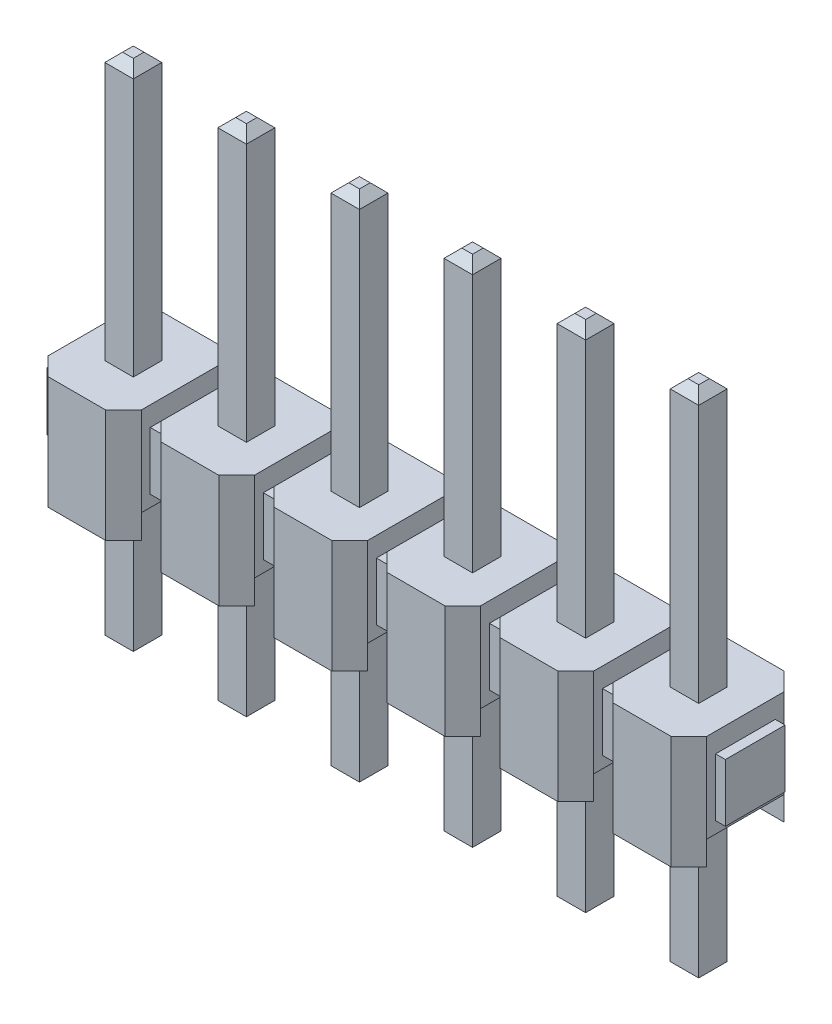
from build123d import *

# Parameters (mm, degrees)
EXTRUDE_2_DEPTH                    = 2.54
EXTRUDE_2_2_DEPTH                  = 2.54
EXTRUDE_2_3_DEPTH                  = 2.54
EXTRUDE_2_4_DEPTH                  = 2.54
EXTRUDE_2_5_DEPTH                  = 2.54
EXTRUDE_2_6_DEPTH                  = 2.54
EXTRUDE_START                      = 0.8
SKETCH_3_W                         = 0.22
SKETCH_3_H                         = 1.34
EXTRUDE_3_DEPTH                    = 1.3
SKETCH_4_W                         = 1.74
SKETCH_4_H                         = 0.54
CUT_EXTRUDE_1_DEPTH                = 16.28610153
EXTRUDE_START_2                    = -3
SKETCH_5_W                         = 0.64
SKETCH_5_H                         = 0.64
EXTRUDE_4_DEPTH                    = 11.54
CHAMFER_1_SIZE                     = 0.2
CHAMFER_2_SIZE                     = 0.2
PATTERN_LINEAR_1_COUNT             = 6
PATTERN_LINEAR_1_PITCH             = 2.54
CHAMFER_1_OF_PATTERN_LINEAR_1_SIZE = 0.2
CHAMFER_2_OF_PATTERN_LINEAR_1_SIZE = 0.2


with BuildPart() as part:
    # Эскиз2 → Бобышка-Вытянуть2 (new body)
    with BuildSketch(Plane(origin=(0, 0, 0), x_dir=(1, 0, 0), z_dir=(0, 1, 0))):
        Polygon((-1.05, 0.87), (-0.65, 1.27), (0.65, 1.27), (1.05, 0.87), (1.05, -0.87), (0.65, -1.27), (-0.65, -1.27), (-1.05, -0.87), align=None)
    extrude(amount=EXTRUDE_2_DEPTH)



with BuildPart() as body_2:
    # Эскиз2 → Extrude 2 2 (new body)
    with BuildSketch(Plane(origin=(0, 0, 0), x_dir=(1, 0, 0), z_dir=(0, 1, 0))):
        Polygon((1.89, -1.27), (3.19, -1.27), (3.59, -0.87), (3.59, 0.87), (3.19, 1.27), (1.89, 1.27), (1.49, 0.87), (1.49, -0.87), align=None)
    extrude(amount=EXTRUDE_2_2_DEPTH)


with BuildPart() as body_3:
    # Эскиз2 → Extrude 2 3 (new body)
    with BuildSketch(Plane(origin=(0, 0, 0), x_dir=(1, 0, 0), z_dir=(0, 1, 0))):
        Polygon((4.43, -1.27), (5.73, -1.27), (6.13, -0.87), (6.13, 0.87), (5.73, 1.27), (4.43, 1.27), (4.03, 0.87), (4.03, -0.87), align=None)
    extrude(amount=EXTRUDE_2_3_DEPTH)


with BuildPart() as body_4:
    # Эскиз2 → Extrude 2 4 (new body)
    with BuildSketch(Plane(origin=(0, 0, 0), x_dir=(1, 0, 0), z_dir=(0, 1, 0))):
        Polygon((6.97, -1.27), (8.27, -1.27), (8.67, -0.87), (8.67, 0.87), (8.27, 1.27), (6.97, 1.27), (6.57, 0.87), (6.57, -0.87), align=None)
    extrude(amount=EXTRUDE_2_4_DEPTH)


with BuildPart() as body_5:
    # Эскиз2 → Extrude 2 5 (new body)
    with BuildSketch(Plane(origin=(0, 0, 0), x_dir=(1, 0, 0), z_dir=(0, 1, 0))):
        Polygon((9.51, -1.27), (10.81, -1.27), (11.21, -0.87), (11.21, 0.87), (10.81, 1.27), (9.51, 1.27), (9.11, 0.87), (9.11, -0.87), align=None)
    extrude(amount=EXTRUDE_2_5_DEPTH)


with BuildPart() as body_6:
    # Эскиз2 → Extrude 2 6 (new body)
    with BuildSketch(Plane(origin=(0, 0, 0), x_dir=(1, 0, 0), z_dir=(0, 1, 0))):
        Polygon((12.05, -1.27), (13.35, -1.27), (13.75, -0.87), (13.75, 0.87), (13.35, 1.27), (12.05, 1.27), (11.65, 0.87), (11.65, -0.87), align=None)
    extrude(amount=EXTRUDE_2_6_DEPTH)


with BuildPart() as part_1:
    add(part.part)

    add(body_2.part)  # Бобышка-Вытянуть3 merges body 2

    add(body_3.part)  # Бобышка-Вытянуть3 merges body 3

    add(body_4.part)  # Бобышка-Вытянуть3 merges body 4

    add(body_5.part)  # Бобышка-Вытянуть3 merges body 5

    add(body_6.part)  # Бобышка-Вытянуть3 merges body 6
    # Эскиз3 → Бобышка-Вытянуть3 (add)
    with BuildSketch(Plane(origin=(0, 0, 0), x_dir=(1, 0, 0), z_dir=(0, 1, 0)).offset(EXTRUDE_START)):
        with Locations((-1.16, 0)):
            Rectangle(SKETCH_3_W, SKETCH_3_H)
        with Locations((1.16, 0)):
            Rectangle(SKETCH_3_W, SKETCH_3_H)
        with Locations((1.38, 0)):
            Rectangle(SKETCH_3_W, SKETCH_3_H)
        with Locations((3.7, 0)):
            Rectangle(SKETCH_3_W, SKETCH_3_H)
        with Locations((3.92, 0)):
            Rectangle(SKETCH_3_W, SKETCH_3_H)
        with Locations((6.24, 0)):
            Rectangle(SKETCH_3_W, SKETCH_3_H)
        with Locations((6.46, 0)):
            Rectangle(SKETCH_3_W, SKETCH_3_H)
        with Locations((8.78, 0)):
            Rectangle(SKETCH_3_W, SKETCH_3_H)
        with Locations((11.32, 0)):
            Rectangle(SKETCH_3_W, SKETCH_3_H)
        with Locations((11.54, 0)):
            Rectangle(SKETCH_3_W, SKETCH_3_H)
        with Locations((9, 0)):
            Rectangle(SKETCH_3_W, SKETCH_3_H)
        with Locations((13.86, 0)):
            Rectangle(SKETCH_3_W, SKETCH_3_H)
    extrude(amount=EXTRUDE_3_DEPTH)

    # Эскиз4 → Вырез-Вытянуть1 (cut, through all)
    with BuildSketch(Plane.ZY.offset(1.05)):
        with Locations((0, 0.27)):
            Rectangle(SKETCH_4_W, SKETCH_4_H)
    extrude(amount=-CUT_EXTRUDE_1_DEPTH, mode=Mode.SUBTRACT)

    # Эскиз5 → Бобышка-Вытянуть4 (add)
    with BuildSketch(Plane(origin=(0, 0, 0), x_dir=(1, 0, 0), z_dir=(0, 1, 0)).offset(EXTRUDE_START_2)):
        Rectangle(SKETCH_5_W, SKETCH_5_H)
    extrude_4 = extrude(amount=EXTRUDE_4_DEPTH)

    # Фаска1
    chamfer_1_edges = [part_1.edges().sort_by_distance(p)[0] for p in [
        (0.32, 8.54, 0),
        (0, 8.54, -0.32),
        (-0.32, 8.54, 0),
        (0, 8.54, 0.32),
    ]]
    chamfer(chamfer_1_edges, length=CHAMFER_1_SIZE)

    # Фаска2
    chamfer_2_edges = [part_1.edges().sort_by_distance(p)[0] for p in [
        (0.32, -3, 0),
        (0, -3, 0.32),
        (-0.32, -3, 0),
        (0, -3, -0.32),
    ]]
    chamfer(chamfer_2_edges, length=CHAMFER_2_SIZE)

    # Линейный массив1: Бобышка-Вытянуть4 ×6
    with Locations(*[(i * PATTERN_LINEAR_1_PITCH, 0, 0) for i in range(1, PATTERN_LINEAR_1_COUNT)]):
        add(extrude_4)

    # Фаска1 of Линейный массив1
    chamfer_1_of_pattern_linear_1_edges = [part_1.edges().sort_by_distance(p)[0] for p in [
        (2.86, 8.54, 0),
        (2.54, 8.54, -0.32),
        (2.22, 8.54, 0),
        (2.54, 8.54, 0.32),
        (5.4, 8.54, 0),
        (5.08, 8.54, -0.32),
        (4.76, 8.54, 0),
        (5.08, 8.54, 0.32),
        (7.94, 8.54, 0),
        (7.62, 8.54, -0.32),
        (7.3, 8.54, 0),
        (7.62, 8.54, 0.32),
        (10.48, 8.54, 0),
        (10.16, 8.54, -0.32),
        (9.84, 8.54, 0),
        (10.16, 8.54, 0.32),
        (13.02, 8.54, 0),
        (12.7, 8.54, -0.32),
        (12.38, 8.54, 0),
        (12.7, 8.54, 0.32),
    ]]
    chamfer(chamfer_1_of_pattern_linear_1_edges, length=CHAMFER_1_OF_PATTERN_LINEAR_1_SIZE)

    # Фаска2 of Линейный массив1
    chamfer_2_of_pattern_linear_1_edges = [part_1.edges().sort_by_distance(p)[0] for p in [
        (2.86, -3, 0),
        (2.54, -3, 0.32),
        (2.22, -3, 0),
        (2.54, -3, -0.32),
        (5.4, -3, 0),
        (5.08, -3, 0.32),
        (4.76, -3, 0),
        (5.08, -3, -0.32),
        (7.94, -3, 0),
        (7.62, -3, 0.32),
        (7.3, -3, 0),
        (7.62, -3, -0.32),
        (10.48, -3, 0),
        (10.16, -3, 0.32),
        (9.84, -3, 0),
        (10.16, -3, -0.32),
        (13.02, -3, 0),
        (12.7, -3, 0.32),
        (12.38, -3, 0),
        (12.7, -3, -0.32),
    ]]
    chamfer(chamfer_2_of_pattern_linear_1_edges, length=CHAMFER_2_OF_PATTERN_LINEAR_1_SIZE)


solid = part_1.part
